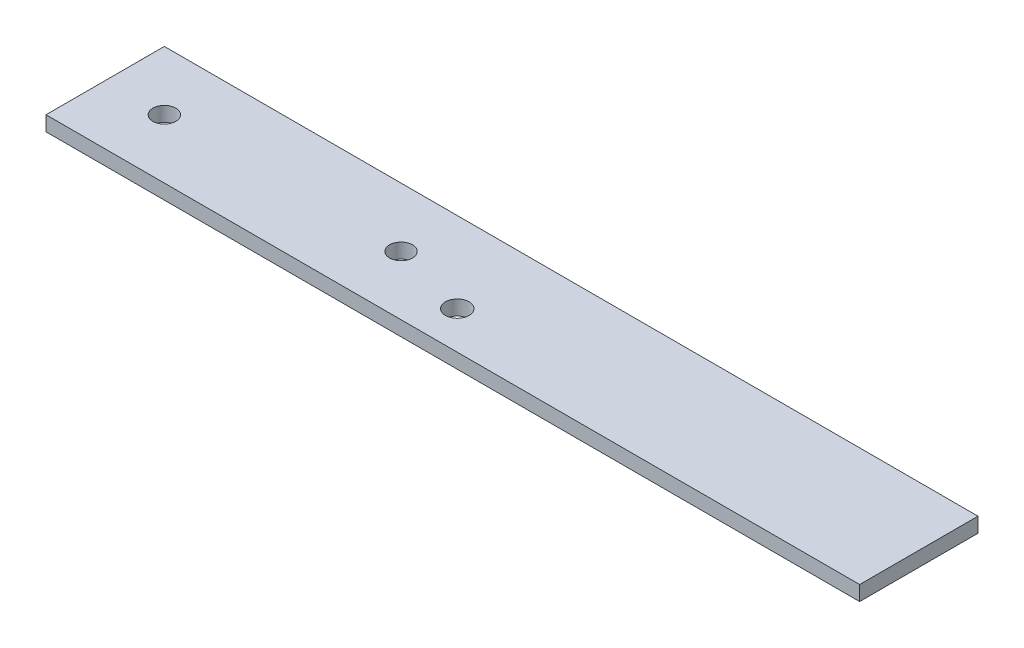
from build123d import *

# Parameters (mm, degrees)
ESQUISSE1_W        = 110
ESQUISSE1_H        = 16
ESQUISSE1_R        = 1.55
ESQUISSE1_R_2      = 1.6
BOSS_EXTRU_1_DEPTH = 2


with BuildPart() as part:
    # Esquisse1 → Boss.-Extru.1 (new body)
    with BuildSketch(Plane(origin=(0, 0, 0), x_dir=(1, 0, 0), z_dir=(0, 1, 0))):
        with Locations((55, 8)):
            Rectangle(ESQUISSE1_W, ESQUISSE1_H)
        with Locations(Location((8, 8, 0), (0, 0, 270))):
            Circle(ESQUISSE1_R, mode=Mode.SUBTRACT)
        with Locations(Location((40, 8, 0), (0, 0, 270))):
            Circle(ESQUISSE1_R, mode=Mode.SUBTRACT)
        with Locations(Location((50.5, 5.1, 0), (0, 0, 270))):
            Circle(ESQUISSE1_R_2, mode=Mode.SUBTRACT)
    extrude(amount=BOSS_EXTRU_1_DEPTH)


solid = part.part
